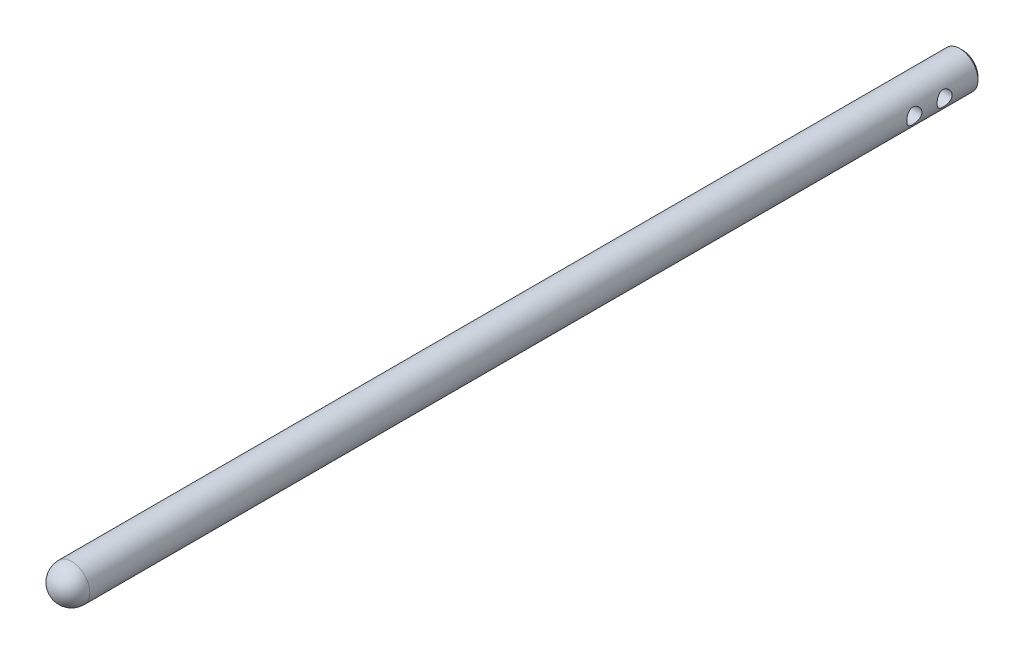
from build123d import *

# Parameters (mm, degrees)
CROQUIS1_R                 = 6
SALIENTE_EXTRUIR1_DEPTH    = 300
REDONDEO1_R                = 6
CORTAR_EXTRUIR1_DEPTH      = 301.11997601
CORTAR_EXTRUIR1_DEPTH_BACK = 301.11997601
CROQUIS2_R                 = 2.5
CHAFL_N1_SIZE              = 1


with BuildPart() as part:
    # Croquis1 → Saliente-Extruir1 (new body)
    with BuildSketch(Plane.XY):
        Circle(CROQUIS1_R)
    extrude(amount=SALIENTE_EXTRUIR1_DEPTH)

    # Redondeo1
    redondeo1_edges = [part.edges().sort_by_distance(p)[0] for p in [
        (-6, 0, 300),
    ]]
    fillet(redondeo1_edges, radius=REDONDEO1_R)

    # Croquis2 → Cortar-Extruir1 (cut, two sides: drawn at the far end of the back side and taken through both)
    with BuildSketch(Plane(origin=(0, 0, 0), x_dir=(0, 0, -1), z_dir=(1, 0, 0)).offset(-CORTAR_EXTRUIR1_DEPTH_BACK)):
        with Locations((-12, 0)):
            Circle(CROQUIS2_R)
        with Locations((-22, 0)):
            Circle(CROQUIS2_R)
    extrude(amount=CORTAR_EXTRUIR1_DEPTH + CORTAR_EXTRUIR1_DEPTH_BACK, mode=Mode.SUBTRACT)

    # Chaflán1
    chafl_n1_edges = [part.edges().sort_by_distance(p)[0] for p in [
        (-6, 0, 0),
    ]]
    chamfer(chafl_n1_edges, length=CHAFL_N1_SIZE)


solid = part.part
